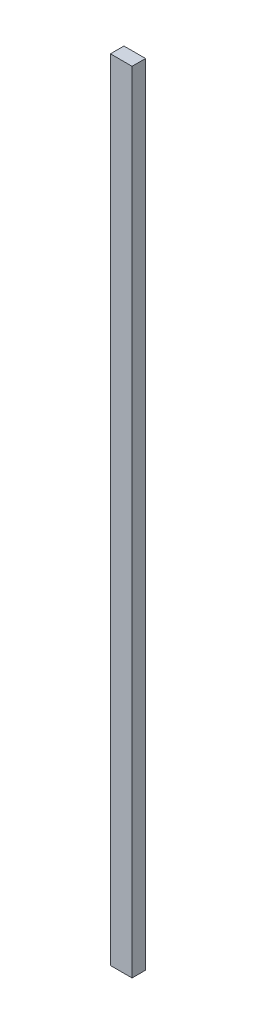
from build123d import *

# Parameters (mm, degrees)
STORE_KABLO_KANALI_DIKEY_40X25_1_START = -727
SKETCH1_W                              = 40
SKETCH1_H                              = 1460
STORE_KABLO_KANALI_DIKEY_40X25_1_DEPTH = 25


with BuildPart() as part:
    # Sketch1 → STORE_kablo_kanali_dikey_40x25_1 (new body)
    with BuildSketch(Plane.XY.offset(STORE_KABLO_KANALI_DIKEY_40X25_1_START)):
        with Locations((1310, 930)):
            Rectangle(SKETCH1_W, SKETCH1_H)
    extrude(amount=-STORE_KABLO_KANALI_DIKEY_40X25_1_DEPTH)


solid = part.part
